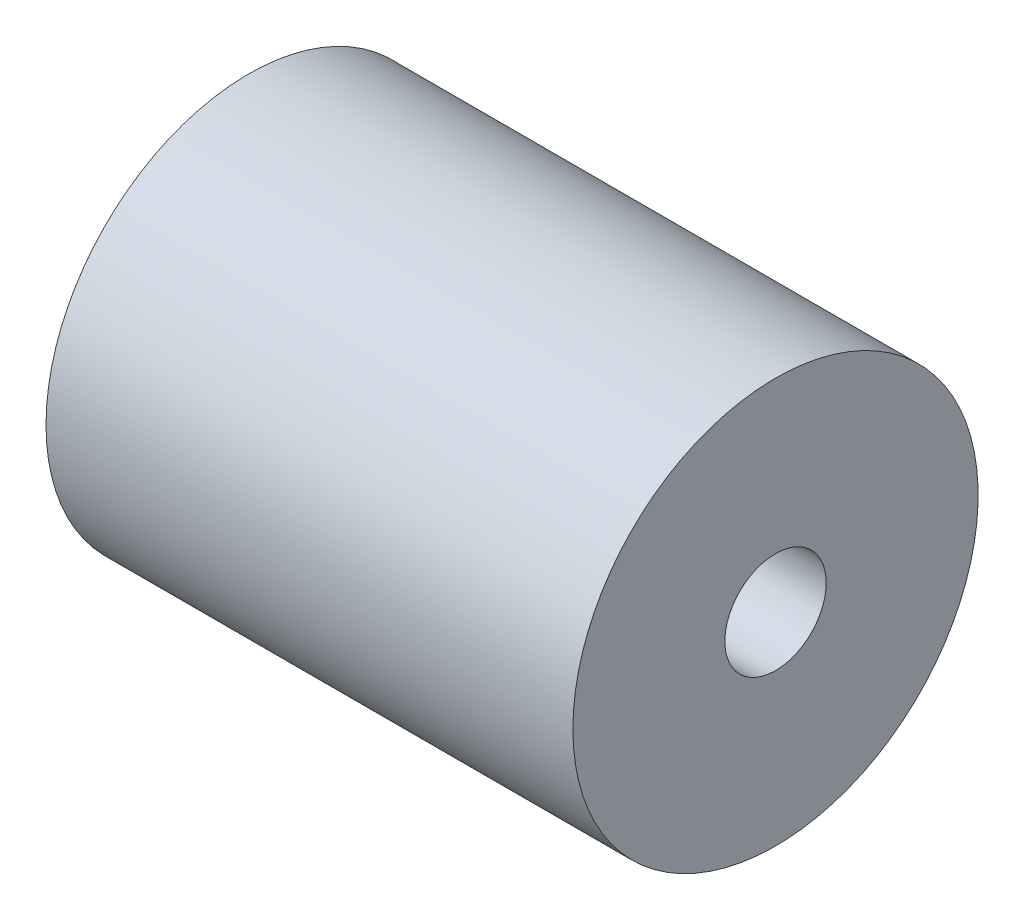
from build123d import *

# Parameters (mm, degrees)
SKETCH1_R           = 10
BOSS_EXTRUDE1_DEPTH = 13
SKETCH2_R           = 2.5
CUT_EXTRUDE1_DEPTH  = 13
SKETCH3_R           = 4
CUT_EXTRUDE2_DEPTH  = 13


with BuildPart() as part:
    # Sketch1 → Boss-Extrude1 (new, symmetric)
    with BuildSketch(Plane(origin=(0, 0, 0), x_dir=(0, 0, -1), z_dir=(1, 0, 0))):
        with Locations(Location((0, 0, 0), (0, 0, 180))):
            Circle(SKETCH1_R)
    extrude(amount=BOSS_EXTRUDE1_DEPTH, both=True)

    # Sketch2 → Cut-Extrude1 (cut)
    with BuildSketch(Plane(origin=(13, 0, 0), x_dir=(0, 0, -1), z_dir=(1, 0, 0))):
        Circle(SKETCH2_R)
    extrude(amount=-CUT_EXTRUDE1_DEPTH, mode=Mode.SUBTRACT)

    # Sketch3 → Cut-Extrude2 (cut)
    with BuildSketch(Plane.ZY.offset(13)):
        Circle(SKETCH3_R)
    extrude(amount=-CUT_EXTRUDE2_DEPTH, mode=Mode.SUBTRACT)


solid = part.part
